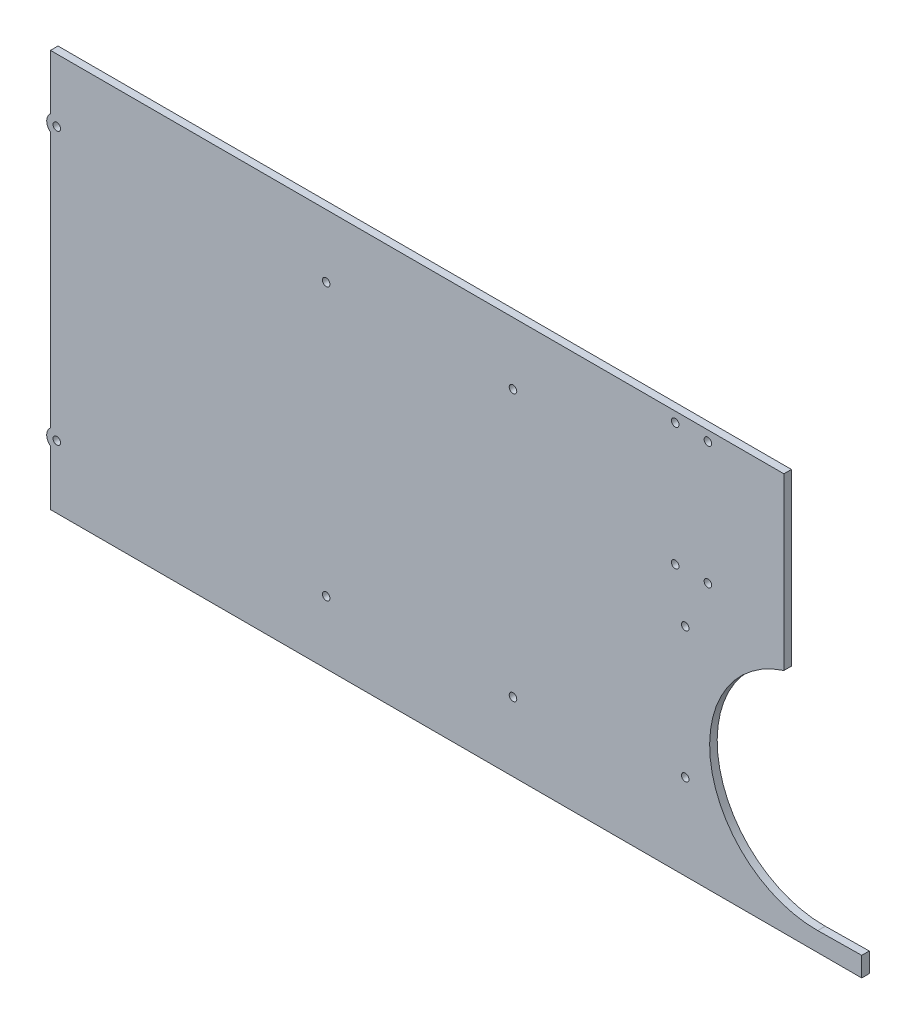
from build123d import *

# Parameters (mm, degrees)
BOSS_EXTRUDE1_DEPTH = 3
CUT_EXTRUDE1_DEPTH  = 3
SKETCH10_R          = 1.5
CUT_EXTRUDE2_DEPTH  = 4
SKETCH11_R          = 1.5
CUT_EXTRUDE3_DEPTH  = 4
SKETCH12_R          = 1.5
CUT_EXTRUDE4_DEPTH  = 10
SKETCH13_R          = 1.5
CUT_EXTRUDE5_DEPTH  = 10
SKETCH15_R          = 1.5
CUT_EXTRUDE6_DEPTH  = 10
SKETCH16_R          = 4
SKETCH16_R_2        = 1.5
BOSS_EXTRUDE3_DEPTH = 3


with BuildPart() as part:
    # Sketch1 → Boss-Extrude1 (new body)
    with BuildSketch(Plane.XY):
        with BuildLine():
            Line((-254.850919962, 60.230742329), (36.781104638, 60.230742329))
            Line((36.781104638, 60.230742329), (36.781104638, -7.509642512))
            ThreePointArc((36.781104638, -7.509642512), (7.803285657, -54.719658484), (50.224189815, -90.342214419))
            Line((50.224189815, -90.342214419), (82.677328038, -89.923825571))
            Line((82.677328038, -89.923825571), (82.677328038, -97.923825571))
            Line((82.677328038, -97.923825571), (-254.850919962, -97.923825571))
            Line((-254.850919962, -97.923825571), (-254.850919962, 60.230742329))
        make_face()
    extrude(amount=BOSS_EXTRUDE1_DEPTH)

    # Sketch3 → Cut-Extrude1 (cut)
    with BuildSketch(Plane.XY.offset(3)):
        Polygon((67.728416495, -97.923825571), (67.728416495, -90.116548316), (82.677328038, -89.923825571), (82.677328038, -97.923825571), align=None)
    extrude(amount=-CUT_EXTRUDE1_DEPTH, mode=Mode.SUBTRACT)

    # Sketch10 → Cut-Extrude2 (cut)
    with BuildSketch(Plane.XY.offset(3)):
        with Locations((-2.442671962, -11.923825571)):
            Circle(SKETCH10_R)
        with Locations((-2.442671962, -63.923825571)):
            Circle(SKETCH10_R)
    extrude(amount=-CUT_EXTRUDE2_DEPTH, mode=Mode.SUBTRACT)

    # Sketch11 → Cut-Extrude3 (cut)
    with BuildSketch(Plane.XY.offset(3)):
        with Locations((-70.942671962, 35.507538029)):
            Circle(SKETCH11_R)
        with Locations((-70.942671962, -70.492461971)):
            Circle(SKETCH11_R)
    extrude(amount=-CUT_EXTRUDE3_DEPTH, mode=Mode.SUBTRACT)

    # Sketch12 → Cut-Extrude4 (cut)
    with BuildSketch(Plane.XY.offset(3)):
        with Locations((-6.43991594, 56.230742329)):
            Circle(SKETCH12_R)
        with Locations((6.56008406, 56.230742329)):
            Circle(SKETCH12_R)
        with Locations((6.56008406, 7.430742329)):
            Circle(SKETCH12_R)
        with Locations((-6.43991594, 7.430742329)):
            Circle(SKETCH12_R)
    extrude(amount=-CUT_EXTRUDE4_DEPTH, mode=Mode.SUBTRACT)

    # Sketch13 → Cut-Extrude5 (cut)
    with BuildSketch(Plane.XY.offset(3)):
        with Locations((-145.230919962, 35.230742329)):
            Circle(SKETCH13_R)
        with Locations((-145.230919962, -72.923825571)):
            Circle(SKETCH13_R)
    extrude(amount=-CUT_EXTRUDE5_DEPTH, mode=Mode.SUBTRACT)

    # Sketch15 → Cut-Extrude6 (cut)
    with BuildSketch(Plane.XY.offset(3)):
        with Locations((-252.350919962, -72.919257671)):
            Circle(SKETCH15_R)
        with Locations((-252.350919962, 35.226174429)):
            Circle(SKETCH15_R)
    extrude(amount=-CUT_EXTRUDE6_DEPTH, mode=Mode.SUBTRACT)

    # Sketch16 → Boss-Extrude3 (add)
    # profile 1 of 2: a face of its own
    with BuildSketch(Plane.XY.offset(3)):
        with Locations((-252.350919962, -72.919257671)):
            Circle(SKETCH16_R)
        with Locations((-252.350919962, -72.919257671)):
            Circle(SKETCH16_R_2, mode=Mode.SUBTRACT)
    # profile 2 of 2: a face of its own
    with BuildSketch(Plane.XY.offset(3)):
        with Locations((-252.350919962, 35.226174429)):
            Circle(SKETCH16_R)
        with Locations((-252.350919962, 35.226174429)):
            Circle(SKETCH16_R_2, mode=Mode.SUBTRACT)
    extrude(amount=-BOSS_EXTRUDE3_DEPTH)


solid = part.part
